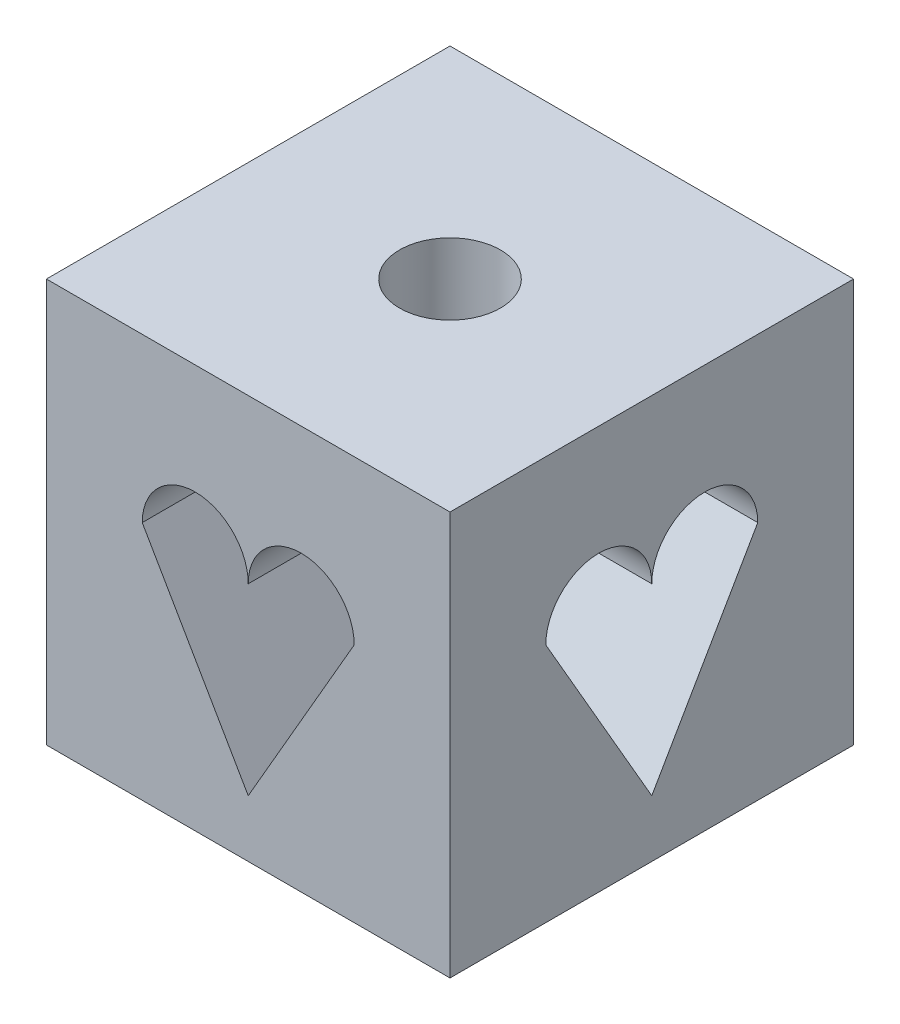
from build123d import *

# Parameters (mm, degrees)
SKETCH1_W           = 100
SKETCH1_H           = 100
BOSS_EXTRUDE1_DEPTH = 100
CUT_EXTRUDE1_DEPTH  = 50
CIRPATTERN1_COUNT   = 4
SKETCH3_R           = 12.5
CUT_EXTRUDE2_DEPTH  = 50


with BuildPart() as part:
    # Sketch1 → Boss-Extrude1 (new body)
    with BuildSketch(Plane(origin=(0, 0, 0), x_dir=(1, 0, 0), z_dir=(0, 1, 0))):
        Rectangle(SKETCH1_W, SKETCH1_H)
    extrude(amount=BOSS_EXTRUDE1_DEPTH)

    # Sketch2 → Cut-Extrude1 (cut)
    with BuildSketch(Plane.XY.offset(50)):
        with BuildLine():
            Line((0, 14.113800065), (-26.260063577, 59.59756439))
            ThreePointArc((-26.260063577, 59.59756439), (-13.130031788, 72.727596179), (0, 59.59756439))
            ThreePointArc((0, 59.59756439), (13.130031788, 72.727596179), (26.260063577, 59.59756439))
            Line((26.260063577, 59.59756439), (0, 14.113800065))
        make_face()
    cut_extrude1 = extrude(amount=-CUT_EXTRUDE1_DEPTH, mode=Mode.SUBTRACT)

    # CirPattern1: Cut-Extrude1 ×4 about axis
    cirpattern1_axis = Axis((0, -5, 0), (0, 1, 0))
    for i in range(1, CIRPATTERN1_COUNT):
        add(cut_extrude1.rotate(cirpattern1_axis, i * 360 / CIRPATTERN1_COUNT), mode=Mode.SUBTRACT)

    # Sketch3 → Cut-Extrude2 (cut)
    with BuildSketch(Plane(origin=(0, 100, 0), x_dir=(1, 0, 0), z_dir=(0, 1, 0))):
        Circle(SKETCH3_R)
    extrude(amount=-CUT_EXTRUDE2_DEPTH, mode=Mode.SUBTRACT)


solid = part.part
